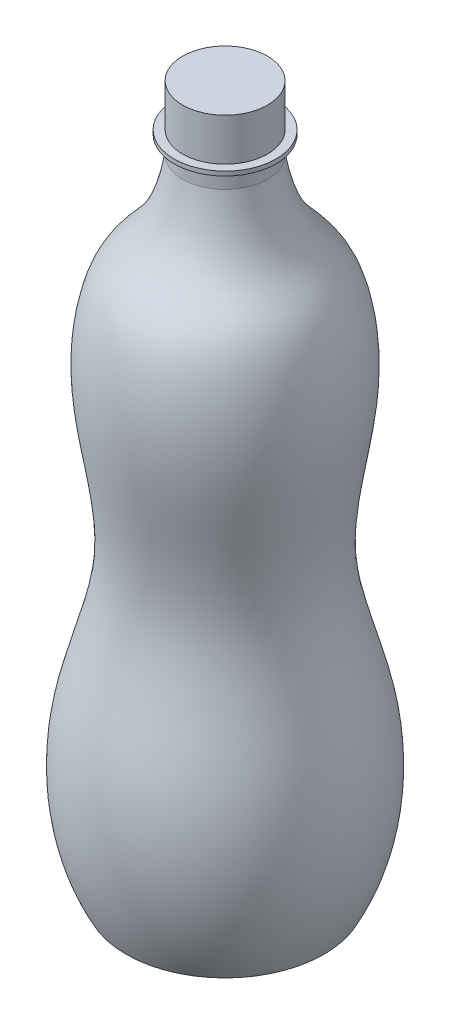
from build123d import *


with BuildPart() as part:
    # Croquis1 → Revolución1 (revolve)
    with BuildSketch(Plane.XY, mode=Mode.PRIVATE) as revoluci_n1_sk:
        with BuildLine():
            Line((0, 250), (-15, 250))
            Line((-15, 250), (-15, 235))
            Line((-15, 235), (-18, 235))
            Line((-18, 235), (-18, 233.5))
            Line((-18, 233.5), (-15, 233.5))
            Line((-15, 233.5), (-15, 227.283149652))
            add(Edge.make_bspline(
                [(-15, 227.283149652), (-16.277986715, 219.305420885), (-19.489344326, 206.260916929), (-32.684348565, 194.323220301), (-38.547275622, 176.702280824), (-39.162662254, 152.86461741), (-33.561571476, 127.462649854), (-30.990721493, 94.977950046), (-48.241664637, 54.863367585), (-44.557007193, 17.989663347), (-35, 0)],
                knots=[0, 0, 0, 0, 0.105527687, 0.159807734, 0.221005565, 0.335010102, 0.459707985, 0.552192154, 0.743984647, 1, 1, 1, 1], degree=3))
            Line((-35, 0), (0, 0))
            Line((0, 0), (0, 250))
        make_face()
    revolve(revoluci_n1_sk.sketch.rotate(Axis((0, 0, 0), (0, 1, 0)), 270), axis=Axis((0, 0, 0), (0, 1, 0)))


solid = part.part
